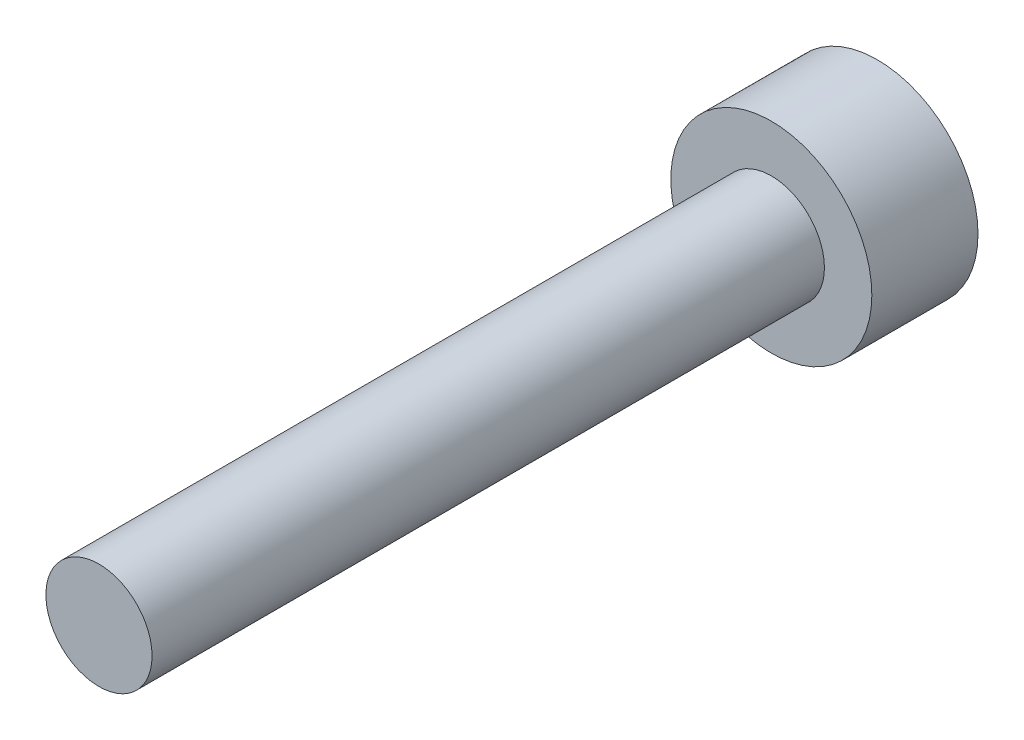
from build123d import *

# Parameters (mm, degrees)
SKETCH_1_R      = 2.84
EXTRUDE_1_DEPTH = 3
SKETCH_2_R      = 1.5
EXTRUDE_2_DEPTH = 22


with BuildPart() as part:
    # 草图1 → 凸台-拉伸1 (new body)
    with BuildSketch(Plane.XY):
        Circle(SKETCH_1_R)
    extrude(amount=EXTRUDE_1_DEPTH)

    # 草图2 → 凸台-拉伸2 (add)
    with BuildSketch(Plane.XY):
        Circle(SKETCH_2_R)
    extrude(amount=EXTRUDE_2_DEPTH)


solid = part.part
